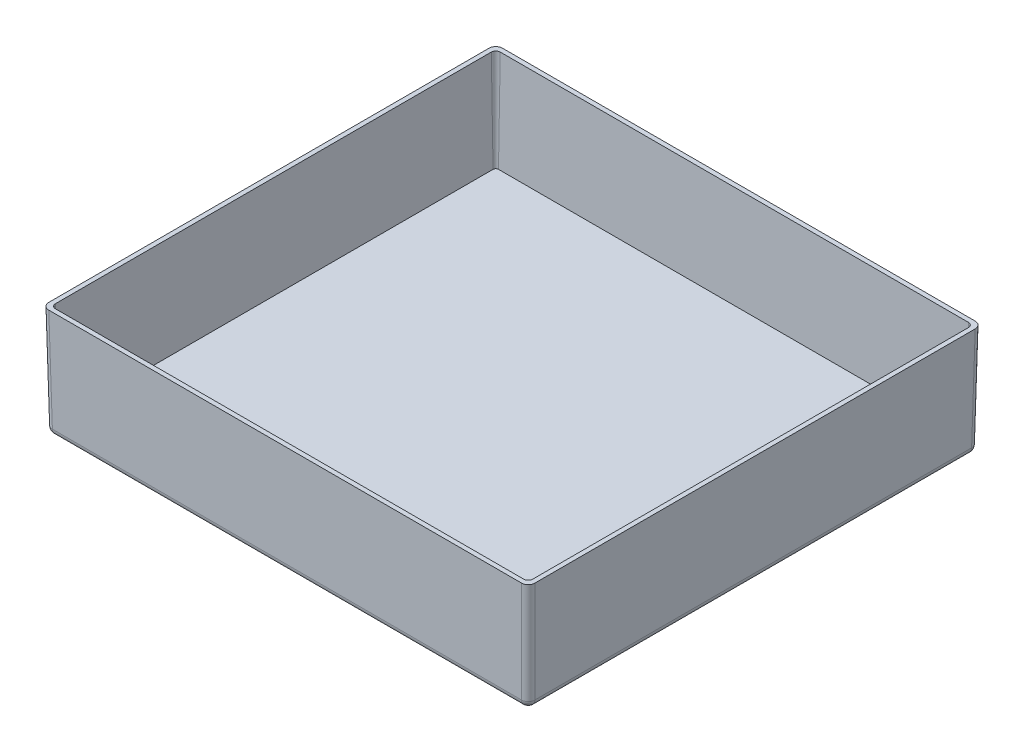
from build123d import *

# Parameters (mm, degrees)
SKETCH1_W           = 215.5
SKETCH1_H           = 201
BOSS_EXTRUDE1_DEPTH = 49
BOSS_EXTRUDE1_DRAFT = -1
FILLET1_R           = 3
CUT_EXTRUDE1_DEPTH  = 45
CUT_EXTRUDE1_DRAFT  = -1


with BuildPart() as part:
    # Sketch1 → Boss-Extrude1 (with draft: the straight prism first)
    with BuildSketch(Plane(origin=(0, 0, 0), x_dir=(1, 0, 0), z_dir=(0, 1, 0))):
        Rectangle(SKETCH1_W, SKETCH1_H)
    extrude(amount=BOSS_EXTRUDE1_DEPTH)
    # Boss-Extrude1: the draft: its side faces are tilted about the plane it starts from
    boss_extrude1_sides = [part.faces().sort_by_distance(p)[0] for p in [
        (0, 24.5, 100.5),
        (107.75, 24.5, 0),
        (0, 24.5, -100.5),
        (-107.75, 24.5, 0),
    ]]
    draft(boss_extrude1_sides, Plane(origin=(0, 0, 0), x_dir=(1, 0, 0), z_dir=(0, 1, 0)), BOSS_EXTRUDE1_DRAFT)

    # Fillet1
    fillet1_edges = [part.edges().sort_by_distance(p)[0] for p in [
        (0, 0, -100.5),
        (-108.177649091, 24.5, -100.927649091),
        (108.177649091, 24.5, -100.927649091),
        (107.75, 0, 0),
        (108.177649091, 24.5, 100.927649091),
        (-107.75, 0, 0),
        (0, 0, 100.5),
        (-108.177649091, 24.5, 100.927649091),
    ]]
    fillet(fillet1_edges, radius=FILLET1_R)


with BuildPart() as cut_extrude1_tool:
    # Sketch2 → Cut-Extrude1 (with draft: the straight prism first)
    with BuildSketch(Plane(origin=(0, 49, 0), x_dir=(1, 0, 0), z_dir=(0, 1, 0))):
        with BuildLine():
            Line((-104.605298181, -99.355298181), (104.605298181, -99.355298181))
            ThreePointArc((104.605298181, -99.355298181), (106.019511744, -98.769511744), (106.605298181, -97.355298181))
            Line((106.605298181, -97.355298181), (106.605298181, 97.355298181))
            ThreePointArc((106.605298181, 97.355298181), (106.019511744, 98.769511744), (104.605298181, 99.355298181))
            Line((104.605298181, 99.355298181), (-104.605298181, 99.355298181))
            ThreePointArc((-104.605298181, 99.355298181), (-106.019511744, 98.769511744), (-106.605298181, 97.355298181))
            Line((-106.605298181, 97.355298181), (-106.605298181, -97.355298181))
            ThreePointArc((-106.605298181, -97.355298181), (-106.019511744, -98.769511744), (-104.605298181, -99.355298181))
        make_face()
    extrude(amount=-CUT_EXTRUDE1_DEPTH)
    # Cut-Extrude1: the draft: its side faces are tilted about the plane it starts from
    cut_extrude1_sides = [cut_extrude1_tool.faces().sort_by_distance(p)[0] for p in [
        (0, 26.5, 99.355298181),
        (106.019511744, 26.5, 98.769511744),
        (106.605298181, 26.5, 0),
        (106.019511744, 26.5, -98.769511744),
        (0, 26.5, -99.355298181),
        (-106.019511744, 26.5, -98.769511744),
        (-106.605298181, 26.5, 0),
        (-106.019511744, 26.5, 98.769511744),
    ]]
    draft(cut_extrude1_sides, Plane(origin=(0, 49, 0), x_dir=(1, 0, 0), z_dir=(0, 1, 0)), CUT_EXTRUDE1_DRAFT)


with BuildPart() as part_1:
    add(part.part)

    # Cut-Extrude1: cut by cut_extrude1_tool
    add(cut_extrude1_tool.part, mode=Mode.SUBTRACT)


solid = part_1.part
